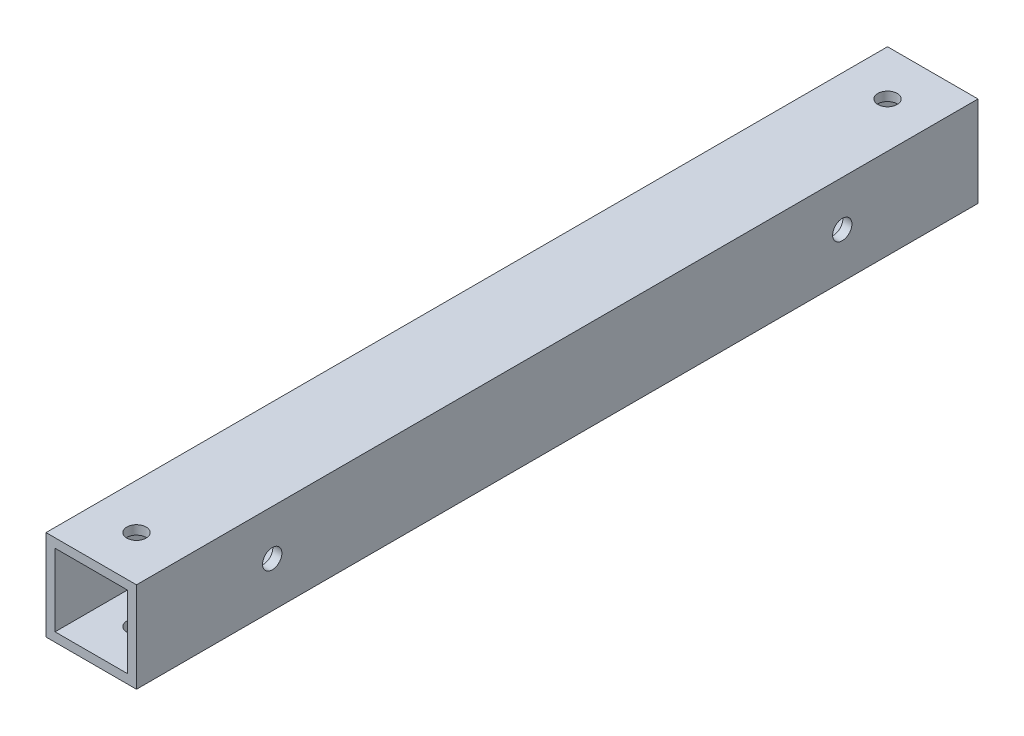
from build123d import *

# Parameters (mm, degrees)
SKETCH_1_W          = 15
SKETCH_1_H          = 15
SKETCH_1_W_2        = 12
SKETCH_1_H_2        = 12
EXTRUDE_1_DEPTH     = 139.5
SKETCH_2_R          = 1.6
CUT_EXTRUDE_1_DEPTH = 141.504448328
SKETCH_3_R          = 1.6
CUT_EXTRUDE_2_DEPTH = 141.504448328


with BuildPart() as part:
    # ｽｹｯﾁ1 → ﾎﾞｽ - 押し出し1 (new body)
    with BuildSketch(Plane.XY):
        Rectangle(SKETCH_1_W, SKETCH_1_H)
        Rectangle(SKETCH_1_W_2, SKETCH_1_H_2, mode=Mode.SUBTRACT)
    extrude(amount=EXTRUDE_1_DEPTH)

    # ｽｹｯﾁ2 → ｶｯﾄ - 押し出し1 (cut, through all)
    with BuildSketch(Plane(origin=(0, 7.5, 0), x_dir=(1, 0, 0), z_dir=(0, 1, 0))):
        with Locations(Location((0, -7.5, 0), (0, 0, 270))):
            Circle(SKETCH_2_R)
        with Locations(Location((0, -132, 0), (0, 0, 270))):
            Circle(SKETCH_2_R)
    extrude(amount=-CUT_EXTRUDE_1_DEPTH, mode=Mode.SUBTRACT)

    # ｽｹｯﾁ3 → ｶｯﾄ - 押し出し2 (cut, through all)
    with BuildSketch(Plane(origin=(7.5, 0, 0), x_dir=(0, 0, -1), z_dir=(1, 0, 0))):
        with Locations((-117, 0)):
            Circle(SKETCH_3_R)
        with Locations((-22.5, 0)):
            Circle(SKETCH_3_R)
    extrude(amount=-CUT_EXTRUDE_2_DEPTH, mode=Mode.SUBTRACT)


solid = part.part
